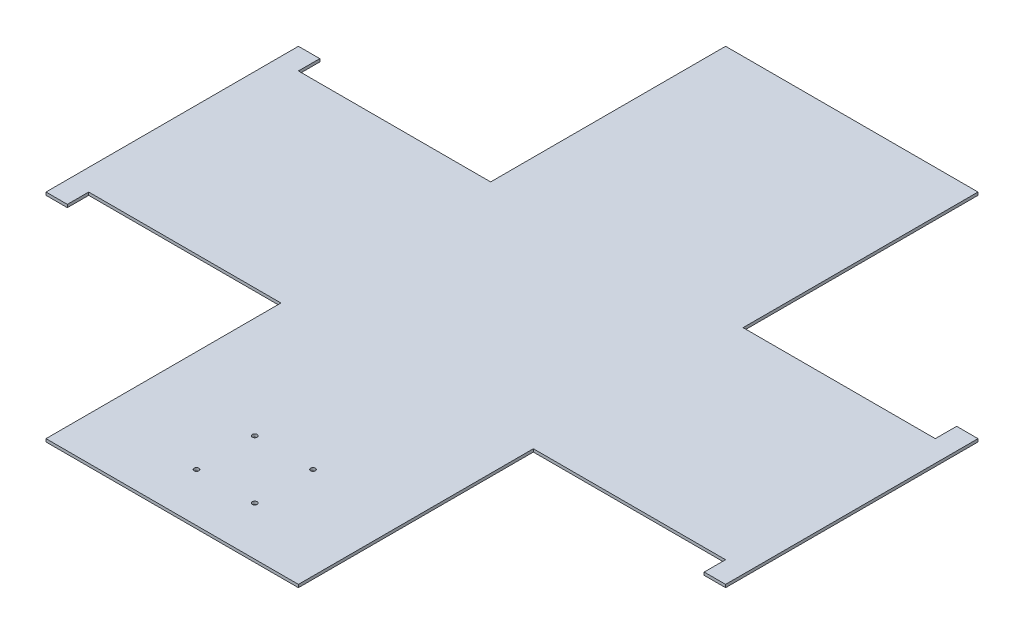
from build123d import *

# Parameters (mm, degrees)
BASE_DEPTH         = 3
SKETCH2_R          = 2.5
CUT_EXTRUDE2_DEPTH = 495.98383812


with BuildPart() as part:
    # Sketch1 → Base (new body)
    with BuildSketch(Plane(origin=(0, 0, 0), x_dir=(1, 0, 0), z_dir=(0, 1, 0))):
        Polygon((-350, -130), (-328, -130), (-328, -108), (-130, -108), (-130, -130), (-130, -350), (130, -350), (130, -130), (130, -108), (328, -108), (328, -130), (350, -130), (350, 130), (328, 130), (328, 108), (130, 108), (130, 130), (130, 350), (-130, 350), (-130, 130), (-130, 108), (-328, 108), (-328, 130), (-350, 130), align=None)
    extrude(amount=BASE_DEPTH)

    # Sketch2 → Cut-Extrude2 (cut, through all)
    with BuildSketch(Plane.XZ):
        with Locations(Location((-25, 300, 0), (0, 0, 270))):
            Circle(SKETCH2_R)
        with Locations(Location((35, 300, 0), (0, 0, 270))):
            Circle(SKETCH2_R)
        with Locations(Location((-25, 240, 0), (0, 0, 270))):
            Circle(SKETCH2_R)
        with Locations(Location((35, 240, 0), (0, 0, 270))):
            Circle(SKETCH2_R)
    extrude(amount=-CUT_EXTRUDE2_DEPTH, mode=Mode.SUBTRACT)


solid = part.part
